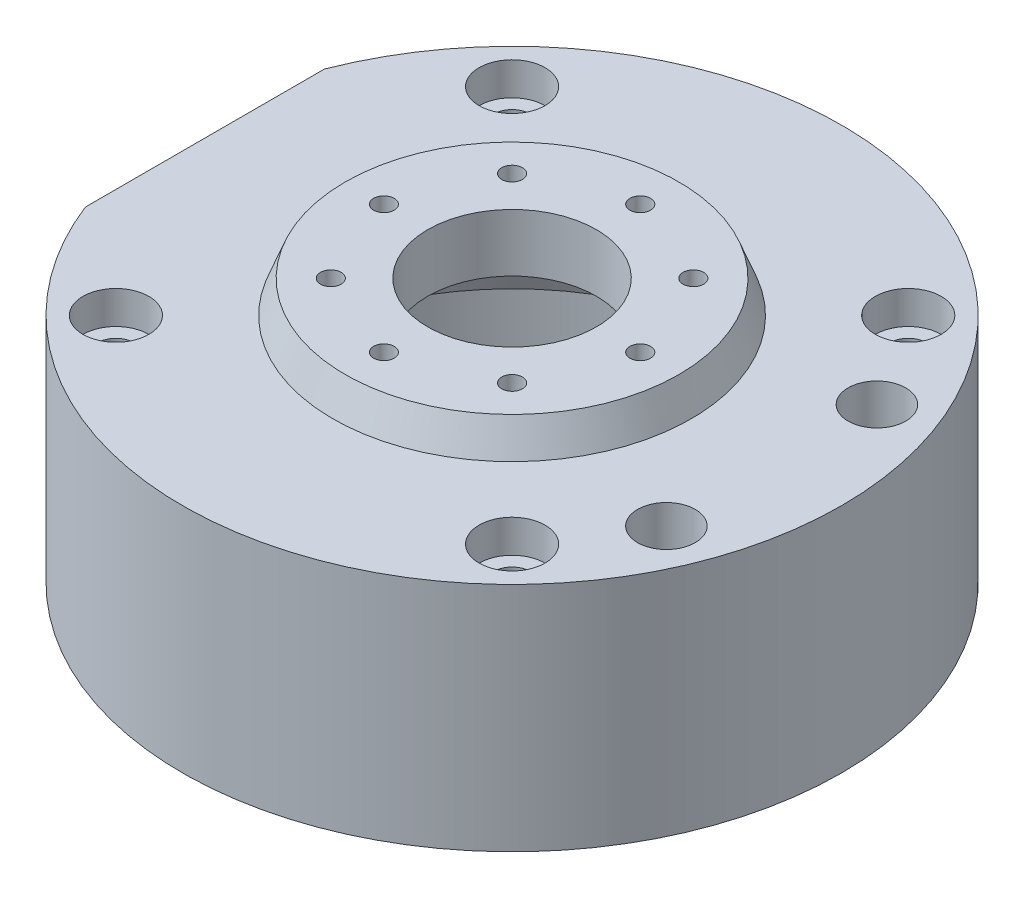
from build123d import *

# Parameters (mm, degrees)
CBORE_FOR_M4_SHCS1_D           = 4.5
CBORE_FOR_M4_SHCS1_CBORE_D     = 8
CBORE_FOR_M4_SHCS1_CBORE_DEPTH = 4
M3X0_5_TAPPED_HOLE1_D          = 2.5
M8X1_0_TAPPED_HOLE1_D          = 7
M8X1_0_TAPPED_HOLE1_DEPTH      = 21
M8X1_0_TAPPED_HOLE1_TIP        = 2.103012167
HOLE1_D                        = 4.4
HOLE1_CBORE_D                  = 7.85
HOLE1_CBORE_DEPTH              = 1.27
CUT_EXTRUDE1_DEPTH             = 65.992307237
CUT_EXTRUDE1_DEPTH_BACK        = 65.992307237
CUT_EXTRUDE2_REACH             = 94.715
M3X0_5_TAPPED_HOLE2_D          = 2.5
M3X0_5_TAPPED_HOLE2_DEPTH      = 7.5
M3X0_5_TAPPED_HOLE2_TIP        = 0.751075774


with BuildPart() as part:
    # Sketch1 → Revolve1 (revolve)
    with BuildSketch(Plane.XY, mode=Mode.PRIVATE) as revolve1_sk:
        Polygon((10.235, 32), (10.235, 25), (25, 25), (29.55, 10), (29.55, 0), (40, 0), (40, 28.1), (21.75, 28.1), (20.25, 32), align=None)
    revolve(revolve1_sk.sketch.rotate(Axis((0, 10.573566085, 0), (0, -1, 0)), 180), axis=Axis((0, 10.573566085, 0), (0, -1, 0)))

    # CBORE for M4 SHCS1 (through all)
    with Locations(Plane(origin=(0, 28.1, 0), x_dir=(1, 0, 0), z_dir=(0, 1, 0))):
        with Locations((-24.04163056, 24.04163056), (24.04163056, 24.04163056), (24.04163056, -24.04163056), (-24.04163056, -24.04163056)):
            CounterBoreHole(CBORE_FOR_M4_SHCS1_D / 2, CBORE_FOR_M4_SHCS1_CBORE_D / 2, CBORE_FOR_M4_SHCS1_CBORE_DEPTH)

    # M3x0.5 Tapped Hole1 (through all)
    with Locations(Plane(origin=(0, 32, 0), x_dir=(1, 0, 0), z_dir=(0, 1, 0))):
        with Locations((-11, 11), (11, 11), (11, -11), (-11, -11), (0, 15.556349186), (15.556349186, 0), (0, -15.556349186), (-15.556349186, 0)):
            Hole(M3X0_5_TAPPED_HOLE1_D / 2)

    # M8x1.0 Tapped Hole1
    with Locations(Plane(origin=(0, 28.1, 0), x_dir=(1, 0, 0), z_dir=(0, 1, 0))):
        with Locations((31.508719031, 12.775), (31.508719031, -12.775)):
            Hole(M8X1_0_TAPPED_HOLE1_D / 2, depth=M8X1_0_TAPPED_HOLE1_DEPTH)
            with Locations((0, 0, -(M8X1_0_TAPPED_HOLE1_DEPTH + M8X1_0_TAPPED_HOLE1_TIP / 2))):  # 118° drill point
                Cone(0, M8X1_0_TAPPED_HOLE1_D / 2, M8X1_0_TAPPED_HOLE1_TIP, mode=Mode.SUBTRACT)

    # Hole1 (through all)
    with Locations(Plane(origin=(0, 0, 0), x_dir=(-1, 0, 0), z_dir=(0, -1, 0))):
        with Locations((-31.508719031, -12.775), (-31.508719031, 12.775)):
            CounterBoreHole(HOLE1_D / 2, HOLE1_CBORE_D / 2, HOLE1_CBORE_DEPTH)

    # Sketch13 → Cut-Extrude1 (cut, two sides: drawn at the far end of the back side and taken through both)
    with BuildSketch(Plane.XZ.offset(-CUT_EXTRUDE1_DEPTH_BACK)):
        with BuildLine():
            Line((-37.279350853, 14.5), (-37.279350853, -14.5))
            ThreePointArc((-37.279350853, -14.5), (-40, 0), (-37.279350853, 14.5))
        make_face()
    extrude(amount=CUT_EXTRUDE1_DEPTH + CUT_EXTRUDE1_DEPTH_BACK, mode=Mode.SUBTRACT)

    # Sketch14 → Cut-Extrude2 (cut, up to next)
    with BuildSketch(Plane.ZY.offset(37.279350853), mode=Mode.PRIVATE) as cut_extrude2_sk1:
        with BuildLine():
            Line((-7, 7.358571571), (-7, 0))
            Line((-7, 0), (7, 0))
            Line((7, 0), (7, 7.358571571))
            ThreePointArc((7, 7.358571571), (0, 24.5), (-7, 7.358571571))
        make_face()
    cut_extrude2_tool1 = extrude(cut_extrude2_sk1.sketch, amount=-CUT_EXTRUDE2_REACH, mode=Mode.PRIVATE) & part.part
    add(cut_extrude2_tool1.solids().sort_by_distance((-37.279351, 12.225831, 0))[0], mode=Mode.SUBTRACT)

    # M3x0.5 Tapped Hole2
    with Locations(Plane.ZY.offset(37.279350853)):
        with Locations((-11, 25.5), (-11, 3.5), (11, 3.5), (11, 25.5)):
            Hole(M3X0_5_TAPPED_HOLE2_D / 2, depth=M3X0_5_TAPPED_HOLE2_DEPTH)
            with Locations((0, 0, -(M3X0_5_TAPPED_HOLE2_DEPTH + M3X0_5_TAPPED_HOLE2_TIP / 2))):  # 118° drill point
                Cone(0, M3X0_5_TAPPED_HOLE2_D / 2, M3X0_5_TAPPED_HOLE2_TIP, mode=Mode.SUBTRACT)


solid = part.part
